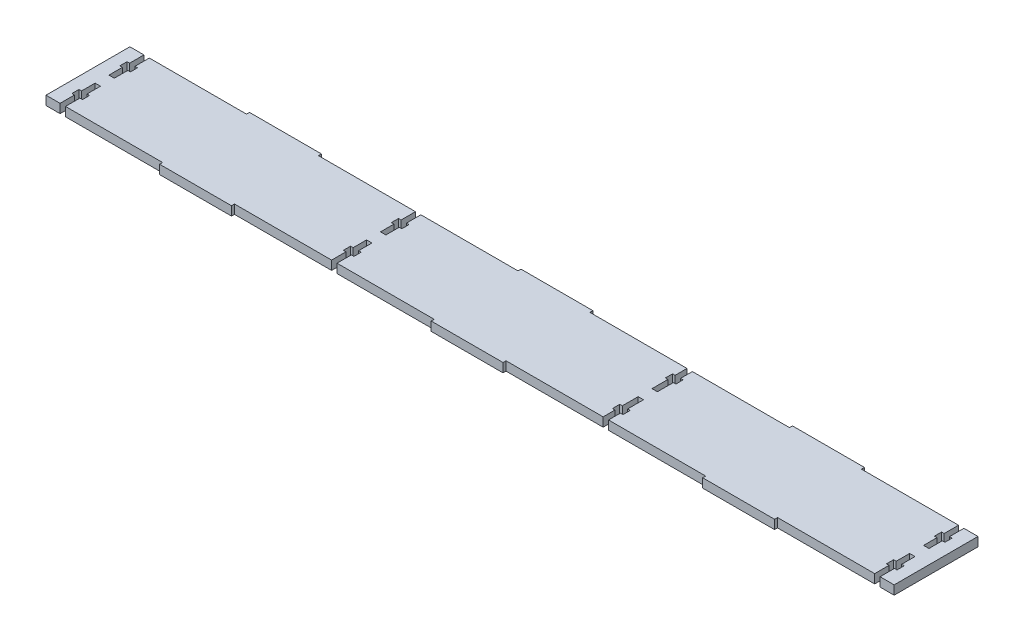
from build123d import *

# Parameters (mm, degrees)
SKETCH1_W           = 457.2
SKETCH1_H           = 47.625
BOSS_EXTRUDE1_DEPTH = 4.7625
SKETCH2_W           = 65.616666667
SKETCH2_H           = 1.5875
SKETCH2_W_2         = 105.833333333
CUT_EXTRUDE1_DEPTH  = 4.7625
SKETCH3_W           = 65.616666667
SKETCH3_H           = 1.5875
SKETCH3_W_2         = 105.833333333
CUT_EXTRUDE3_DEPTH  = 4.7625
CUT_EXTRUDE4_DEPTH  = 4.7625
SKETCH6_W           = 3.81
SKETCH6_H           = 44.45
CUT_EXTRUDE6_DEPTH  = 4.7625


with BuildPart() as part:
    # Sketch1 → Boss-Extrude1 (new body)
    with BuildSketch(Plane(origin=(0, 0, 0), x_dir=(1, 0, 0), z_dir=(0, 1, 0))):
        Rectangle(SKETCH1_W, SKETCH1_H)
    extrude(amount=BOSS_EXTRUDE1_DEPTH)

    # Sketch2 → Cut-Extrude1 (cut)
    with BuildSketch(Plane.XZ):
        with Locations((-195.791666667, 23.01875)):
            Rectangle(SKETCH2_W, SKETCH2_H)
        with Locations((-71.966666667, 23.01875)):
            Rectangle(SKETCH2_W_2, SKETCH2_H)
        with Locations((71.966666667, 23.01875)):
            Rectangle(SKETCH2_W_2, SKETCH2_H)
        with Locations((195.791666667, 23.01875)):
            Rectangle(SKETCH2_W, SKETCH2_H)
    extrude(amount=-CUT_EXTRUDE1_DEPTH, mode=Mode.SUBTRACT)

    # Sketch3 → Cut-Extrude3 (cut)
    with BuildSketch(Plane.XZ):
        with Locations((-195.791666667, -23.01875)):
            Rectangle(SKETCH3_W, SKETCH3_H)
        with Locations((-71.966666667, -23.01875)):
            Rectangle(SKETCH3_W_2, SKETCH3_H)
        with Locations((71.966666667, -23.01875)):
            Rectangle(SKETCH3_W_2, SKETCH3_H)
        with Locations((195.791666667, -23.01875)):
            Rectangle(SKETCH3_W, SKETCH3_H)
    extrude(amount=-CUT_EXTRUDE3_DEPTH, mode=Mode.SUBTRACT)

    # Sketch4 → Cut-Extrude4 (cut)
    with BuildSketch(Plane(origin=(0, 4.7625, 0), x_dir=(1, 0, 0), z_dir=(0, 1, 0))):
        Polygon((217.32875, -22.225), (214.47125, -22.225), (214.47125, -14.605), (213.106, -14.605), (213.106, -10.795), (214.47125, -10.795), (214.47125, -3.683), (217.32875, -3.683), (217.32875, -10.795), (218.694, -10.795), (218.694, -14.605), (217.32875, -14.605), align=None)
        Polygon((73.395413242, -22.225), (73.395413242, -15.940182767), (74.760663242, -15.940182767), (74.760663242, -12.094601121), (73.395413242, -12.094601121), (73.395413242, -3.677534747), (70.537920091, -3.677534747), (70.537920091, -12.094601121), (69.172670091, -12.094601121), (69.172670091, -15.940182767), (70.537920091, -15.940182767), (70.537920091, -22.225), align=None)
        Polygon((-70.537916667, -22.225), (-70.537916667, -14.605), (-69.172666667, -14.605), (-69.172666667, -10.795), (-70.537916667, -10.795), (-70.537916667, -3.683), (-73.395416667, -3.683), (-73.395416667, -10.795), (-74.760666667, -10.795), (-74.760666667, -14.605), (-73.395416667, -14.605), (-73.395416667, -22.225), align=None)
        Polygon((-214.47125, -22.225), (-214.47125, -14.605), (-213.106, -14.605), (-213.106, -10.795), (-214.47125, -10.795), (-214.47125, -3.683), (-217.32875, -3.683), (-217.32875, -10.795), (-218.694, -10.795), (-218.694, -14.605), (-217.32875, -14.605), (-217.32875, -22.225), align=None)
        Polygon((-214.47125, 22.225), (-217.32875, 22.225), (-217.32875, 14.605), (-218.694, 14.605), (-218.694, 10.795), (-217.32875, 10.795), (-217.32875, 3.683), (-214.47125, 3.683), (-214.47125, 10.795), (-213.106, 10.795), (-213.106, 14.605), (-214.47125, 14.605), align=None)
        Polygon((-69.172666667, 14.605), (-70.537916667, 14.605), (-70.537916667, 22.225), (-73.395416667, 22.225), (-73.395416667, 14.605), (-74.760666667, 14.605), (-74.760666667, 10.795), (-73.395416667, 10.795), (-73.395416667, 3.683), (-70.537916667, 3.683), (-70.537916667, 10.795), (-69.172666667, 10.795), align=None)
        Polygon((74.760663242, 15.940182767), (73.395413242, 15.940182767), (73.395413242, 22.225), (70.537920091, 22.225), (70.537920091, 15.940182767), (69.172670091, 15.940182767), (69.172670091, 12.094601121), (70.537920091, 12.094601121), (70.537920091, 3.677534747), (73.395413242, 3.677534747), (73.395413242, 12.094601121), (74.760663242, 12.094601121), align=None)
        Polygon((218.694, 10.795), (217.32875, 10.795), (217.32875, 3.683), (214.47125, 3.683), (214.47125, 10.795), (213.106, 10.795), (213.106, 14.605), (214.47125, 14.605), (214.47125, 22.225), (217.32875, 22.225), (217.32875, 14.605), (218.694, 14.605), align=None)
    extrude(amount=-CUT_EXTRUDE4_DEPTH, mode=Mode.SUBTRACT)

    # Sketch6 → Cut-Extrude6 (cut)
    with BuildSketch(Plane(origin=(0, 4.7625, 0), x_dir=(1, 0, 0), z_dir=(0, 1, 0))):
        with Locations((-226.695, 0)):
            Rectangle(SKETCH6_W, SKETCH6_H)
        with Locations((226.695, 0)):
            Rectangle(SKETCH6_W, SKETCH6_H)
    extrude(amount=-CUT_EXTRUDE6_DEPTH, mode=Mode.SUBTRACT)


solid = part.part
